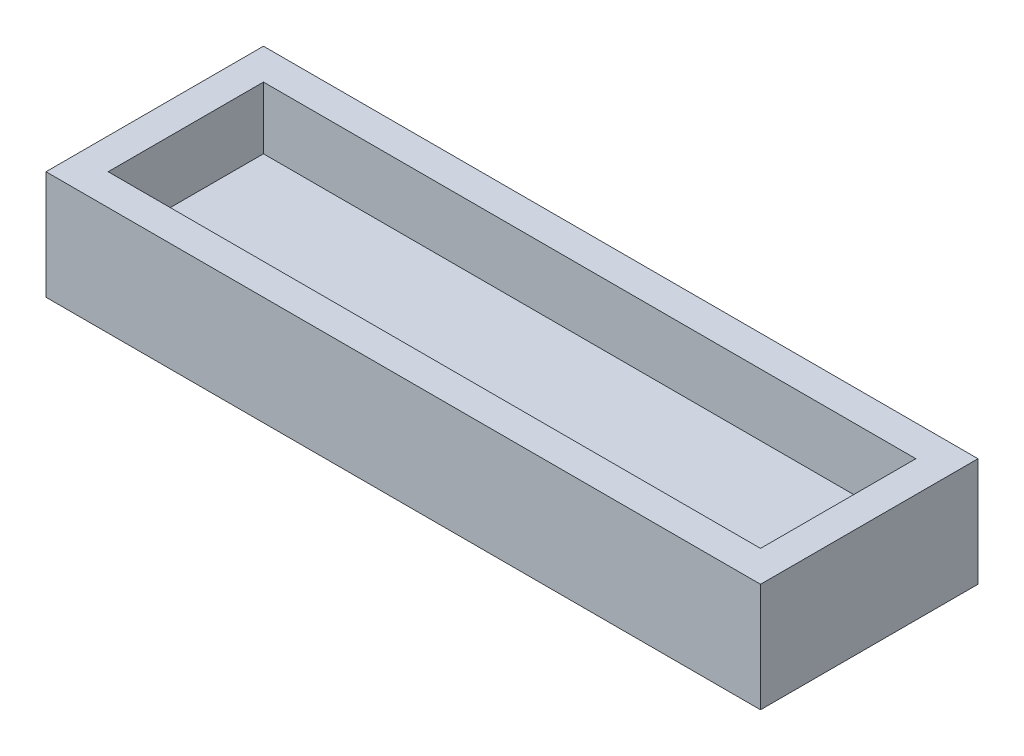
from build123d import *

# Parameters (mm, degrees)
SKETCH1_W           = 42
SKETCH1_H           = 10
BOSS_EXTRUDE1_DEPTH = 3
SKETCH2_W           = 46
SKETCH2_H           = 14
SKETCH2_W_2         = 42
SKETCH2_H_2         = 10
BOSS_EXTRUDE2_DEPTH = 7


with BuildPart() as part:
    # Sketch1 → Boss-Extrude1 (new body)
    with BuildSketch(Plane(origin=(0, 0, 0), x_dir=(1, 0, 0), z_dir=(0, 1, 0))):
        Rectangle(SKETCH1_W, SKETCH1_H)
    extrude(amount=BOSS_EXTRUDE1_DEPTH)

    # Sketch2 → Boss-Extrude2 (add)
    with BuildSketch(Plane.XZ):
        Rectangle(SKETCH2_W, SKETCH2_H)
        Rectangle(SKETCH2_W_2, SKETCH2_H_2, mode=Mode.SUBTRACT)
    extrude(amount=-BOSS_EXTRUDE2_DEPTH)


solid = part.part
